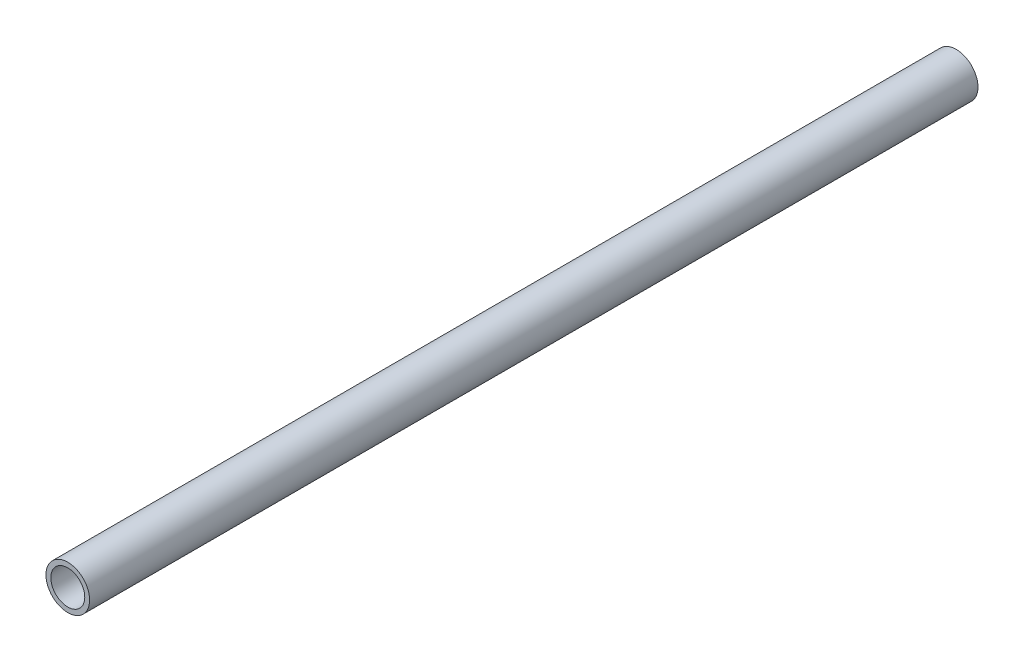
from build123d import *

# Parameters (mm, degrees)
SKETCH1_R           = 9
SKETCH1_R_2         = 7
BOSS_EXTRUDE1_DEPTH = 366.3


with BuildPart() as part:
    # Sketch1 → Boss-Extrude1 (new body)
    with BuildSketch(Plane.XY):
        Circle(SKETCH1_R)
        Circle(SKETCH1_R_2, mode=Mode.SUBTRACT)
    extrude(amount=BOSS_EXTRUDE1_DEPTH)


solid = part.part
